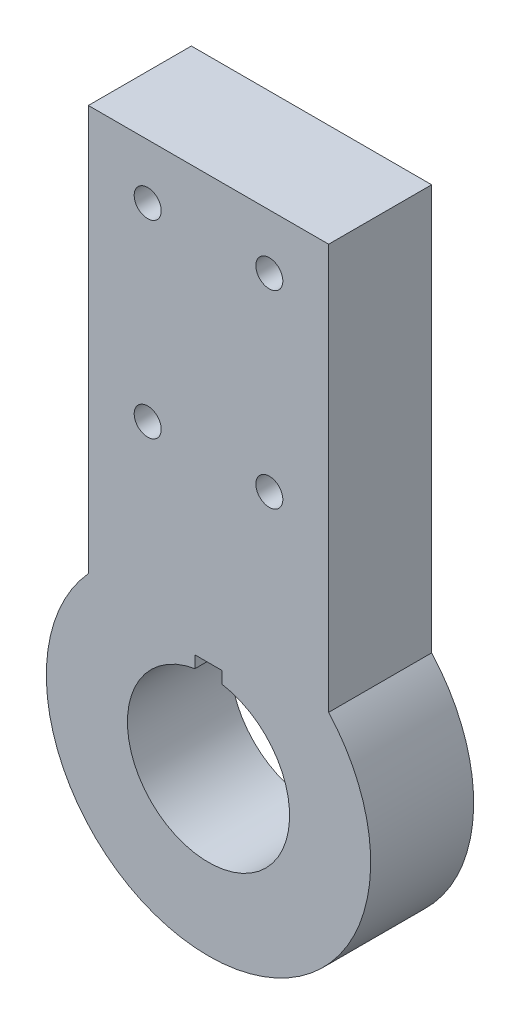
from build123d import *

# Parameters (mm, degrees)
SKETCH1_R           = 15
BOSS_EXTRUDE1_DEPTH = 19.05
SKETCH2_W           = 5
SKETCH2_H           = 17
CUT_EXTRUDE1_DEPTH  = 102.570428297
SKETCH3_R           = 2.5
CUT_EXTRUDE2_DEPTH  = 102.570428297


with BuildPart() as part:
    # Sketch1 → Boss-Extrude1 (new body)
    with BuildSketch(Plane.XY):
        with BuildLine():
            Line((-22.225, 20.150666862), (-22.225, 95.150666862))
            Line((-22.225, 95.150666862), (22.225, 95.150666862))
            Line((22.225, 95.150666862), (22.225, 20.150666862))
            ThreePointArc((22.225, 20.150666862), (0, -30), (-22.225, 20.150666862))
        make_face()
        with Locations(Location((0, 0, 0), (0, 0, 180))):
            Circle(SKETCH1_R, mode=Mode.SUBTRACT)
    extrude(amount=BOSS_EXTRUDE1_DEPTH)

    # Sketch2 → Cut-Extrude1 (cut, through all)
    with BuildSketch(Plane.XY.offset(19.05)):
        with Locations((0, 8.5)):
            Rectangle(SKETCH2_W, SKETCH2_H)
    extrude(amount=-CUT_EXTRUDE1_DEPTH, mode=Mode.SUBTRACT)

    # Sketch3 → Cut-Extrude2 (cut, through all)
    with BuildSketch(Plane.XY.offset(19.05)):
        with Locations((-11.25, 85)):
            Circle(SKETCH3_R)
        with Locations((11.25, 85)):
            Circle(SKETCH3_R)
        with Locations((11.25, 50)):
            Circle(SKETCH3_R)
        with Locations((-11.25, 50)):
            Circle(SKETCH3_R)
    extrude(amount=-CUT_EXTRUDE2_DEPTH, mode=Mode.SUBTRACT)


solid = part.part
